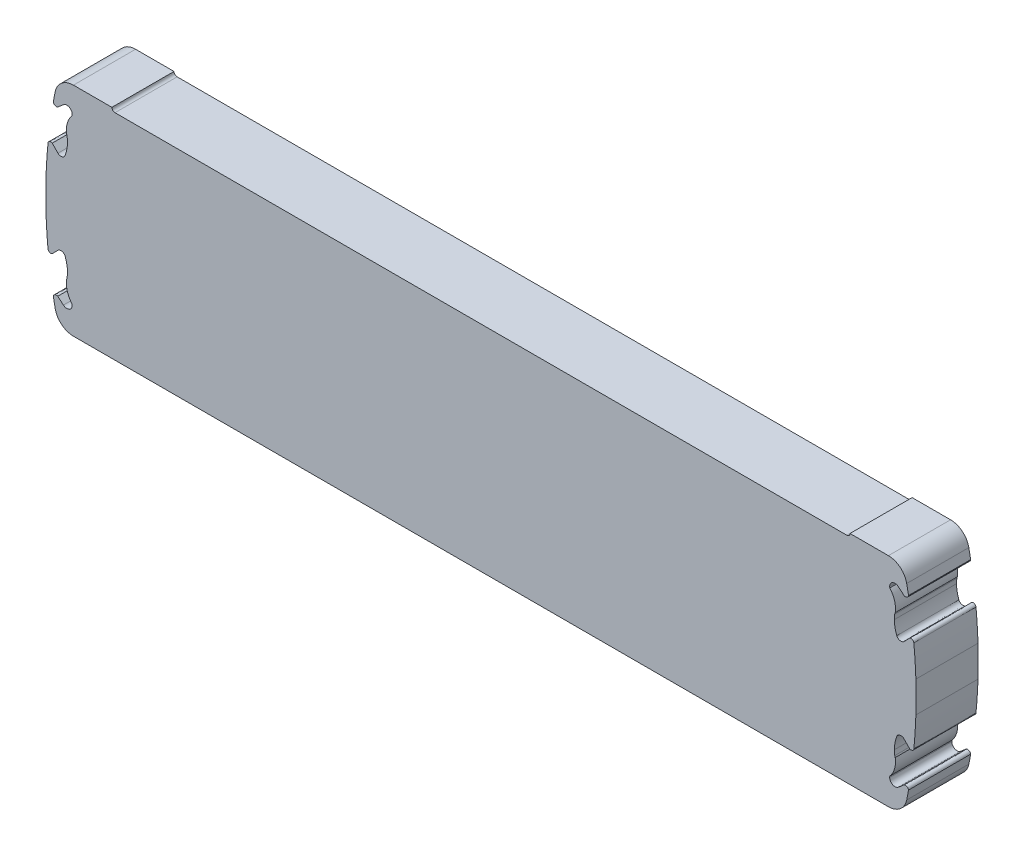
from build123d import *

# Parameters (mm, degrees)
BOSS_EXTRUDE1_DEPTH = 10


with BuildPart() as part:
    # Sketch4 → Boss-Extrude1 (new body)
    with BuildSketch(Plane(origin=(-596.752057113, -420.633982059, 0), x_dir=(1, 0, 0), z_dir=(0, 0, 1))):
        with BuildLine():
            ThreePointArc((537.856383508, 437.883981662), (537.502832434, 438.030428645), (537.356390004, 438.383981605))
            Line((537.356390004, 438.383981605), (531.168761831, 438.383981605))
            ThreePointArc((531.168761831, 438.383981605), (529.26806706, 437.705050192), (528.227666546, 435.975554529))
            ThreePointArc((528.227666546, 435.975554529), (528.077612298, 435.20961824), (527.93527456, 434.442210497))
            add(Edge.make_bspline(
                [(528.645043035, 434.075601683), (528.373422677, 433.904628447), (527.953061604, 434.121752875), (527.93527456, 434.442210497)],
                knots=[0, 0, 0, 0, 1, 1, 1, 1], degree=3))
            add(Edge.make_bspline(
                [(528.645043035, 434.075601683), (528.948206003, 434.333052007), (529.251368972, 434.590502331), (529.55453194, 434.847952656)],
                knots=[0, 0, 0, 0, 1, 1, 1, 1], degree=3))
            ThreePointArc((529.55453194, 434.847952656), (530.559263516, 434.927792658), (530.943234874, 433.995898908))
            ThreePointArc((530.943234874, 433.995898908), (530.266234445, 432.862780603), (530.030548766, 431.564035464))
            ThreePointArc((530.030548766, 431.564035464), (530.04199793, 431.273411596), (530.076251009, 430.984586316))
            add(Edge.make_bspline(
                [(530.076251009, 430.984586316), (530.136438997, 430.87310997), (530.153738674, 430.747609806)],
                knots=[0, 0, 0, 1, 1, 1], degree=2))
            ThreePointArc((530.153738674, 430.747609806), (530.171525682, 429.303646555), (529.832457882, 427.899944565))
            add(Edge.make_bspline(
                [(529.832457882, 427.899944565), (529.664786165, 427.456732189), (529.019825312, 427.315590122), (528.682762303, 427.652660836)],
                knots=[0, 0, 0, 0, 1, 1, 1, 1], degree=3))
            add(Edge.make_bspline(
                [(527.749025131, 428.586405192), (528.060270855, 428.275157074), (528.371516579, 427.963908955), (528.682762303, 427.652660836)],
                knots=[0, 0, 0, 0, 1, 1, 1, 1], degree=3))
            add(Edge.make_bspline(
                [(527.076105496, 428.261094814), (527.101664269, 428.559910263), (527.498966326, 428.751978492), (527.749025131, 428.586405192)],
                knots=[0, 0, 0, 0, 1, 1, 1, 1], degree=3))
            ThreePointArc((527.076105496, 428.261094814), (526.875645149, 425.825092413), (526.752056208, 423.383982457))
            Line((526.752056208, 423.383982457), (526.752056208, 418.383982457))
            ThreePointArc((526.752056208, 418.383982457), (526.875645149, 415.9428725), (527.076105496, 413.506870099))
            add(Edge.make_bspline(
                [(527.749025131, 413.181559721), (527.498966326, 413.015986421), (527.101664269, 413.20805465), (527.076105496, 413.506870099)],
                knots=[0, 0, 0, 0, 1, 1, 1, 1], degree=3))
            add(Edge.make_bspline(
                [(527.749025131, 413.181559721), (528.060270855, 413.492807839), (528.371516579, 413.804055958), (528.682763021, 414.115303358)],
                knots=[0, 0, 0, 0, 1, 1, 1, 1], degree=3))
            add(Edge.make_bspline(
                [(528.682763021, 414.115303358), (529.017832696, 414.450379772), (529.663792656, 414.313863986), (529.832459308, 413.868020888)],
                knots=[0, 0, 0, 0, 1, 1, 1, 1], degree=3))
            ThreePointArc((529.832459308, 413.868020888), (530.171527108, 412.464318898), (530.153740099, 411.020355646))
            add(Edge.make_bspline(
                [(530.153740099, 411.020355646), (530.136437403, 410.894855899), (530.076250924, 410.783379344)],
                knots=[0, 0, 0, 1, 1, 1], degree=2))
            ThreePointArc((530.076250924, 410.783379344), (530.041997846, 410.494554064), (530.030548681, 410.203930197))
            ThreePointArc((530.030548681, 410.203930197), (530.26623436, 408.905185058), (530.94323479, 407.772066752))
            ThreePointArc((530.94323479, 407.772066752), (530.559263583, 406.840182612), (529.554540169, 406.920012427))
            add(Edge.make_bspline(
                [(528.645032562, 407.692363435), (528.948201765, 407.434913099), (529.251370967, 407.177462763), (529.554540169, 406.920012427)],
                knots=[0, 0, 0, 0, 1, 1, 1, 1], degree=3))
            add(Edge.make_bspline(
                [(527.93527456, 407.325754416), (527.953065541, 407.64620576), (528.37341291, 407.863326434), (528.645032562, 407.692363435)],
                knots=[0, 0, 0, 0, 1, 1, 1, 1], degree=3))
            ThreePointArc((527.93527456, 407.325754416), (528.077612382, 406.558346229), (528.227666724, 405.792409498))
            ThreePointArc((528.227666724, 405.792409498), (529.268067244, 404.062913858), (531.168762002, 403.383982456))
            Line((531.168762002, 403.383982456), (537.00283853, 403.383982456))
            Line((537.00283853, 403.383982456), (538.002825655, 403.383982456))
            Line((538.002825655, 403.383982456), (655.501288571, 403.383982456))
            Line((655.501288571, 403.383982456), (656.501275696, 403.383982456))
            Line((656.501275696, 403.383982456), (662.335352383, 403.383982456))
            ThreePointArc((662.335352383, 403.383982456), (664.236047153, 404.062913868), (665.276447667, 405.79240953))
            ThreePointArc((665.276447667, 405.79240953), (665.426501922, 406.558345849), (665.568839666, 407.325753624))
            add(Edge.make_bspline(
                [(664.859071191, 407.692362438), (665.130691549, 407.863335674), (665.551052622, 407.646211246), (665.568839666, 407.325753624)],
                knots=[0, 0, 0, 0, 1, 1, 1, 1], degree=3))
            add(Edge.make_bspline(
                [(664.859071191, 407.692362438), (664.555908222, 407.434912114), (664.252745254, 407.17746179), (663.949582286, 406.920011465)],
                knots=[0, 0, 0, 0, 1, 1, 1, 1], degree=3))
            ThreePointArc((663.949582286, 406.920011465), (663.034925489, 406.792053361), (662.5365948, 407.569637347))
            ThreePointArc((662.5365948, 407.569637347), (662.542665938, 407.671579613), (662.560879352, 407.772065213))
            ThreePointArc((662.560879352, 407.772065213), (663.329283515, 409.181297278), (663.427863217, 410.783377805))
            add(Edge.make_bspline(
                [(663.427863217, 410.783377805), (663.367675229, 410.894854151), (663.350375552, 411.020354315)],
                knots=[0, 0, 0, 1, 1, 1], degree=2))
            ThreePointArc((663.350375552, 411.020354315), (663.309579069, 411.4158969), (663.295980241, 411.813305205))
            ThreePointArc((663.295980241, 411.813305205), (663.390671322, 412.857693016), (663.671656343, 413.868019556))
            add(Edge.make_bspline(
                [(663.671656343, 413.868019556), (663.83932806, 414.311231933), (664.484288913, 414.452373999), (664.821351923, 414.115303285)],
                knots=[0, 0, 0, 0, 1, 1, 1, 1], degree=3))
            add(Edge.make_bspline(
                [(665.755089095, 413.181558929), (665.443843371, 413.492807047), (665.132597647, 413.804055166), (664.821351923, 414.115303285)],
                knots=[0, 0, 0, 0, 1, 1, 1, 1], degree=3))
            add(Edge.make_bspline(
                [(666.42800873, 413.506869307), (666.402449957, 413.208053858), (666.005147899, 413.015985629), (665.755089095, 413.181558929)],
                knots=[0, 0, 0, 0, 1, 1, 1, 1], degree=3))
            ThreePointArc((666.42800873, 413.506869307), (666.628469077, 415.942871708), (666.752058017, 418.383981664))
            Line((666.752058017, 418.383981664), (666.752058017, 423.383981664))
            ThreePointArc((666.752058017, 423.383981664), (666.628469077, 425.825091621), (666.42800873, 428.261094022))
            add(Edge.make_bspline(
                [(665.755089095, 428.5864044), (666.0051479, 428.7519777), (666.402449957, 428.559909471), (666.42800873, 428.261094022)],
                knots=[0, 0, 0, 0, 1, 1, 1, 1], degree=3))
            add(Edge.make_bspline(
                [(665.755089095, 428.5864044), (665.443843371, 428.275156282), (665.132597647, 427.963908163), (664.821351205, 427.652660763)],
                knots=[0, 0, 0, 0, 1, 1, 1, 1], degree=3))
            add(Edge.make_bspline(
                [(664.821351205, 427.652660763), (664.486281529, 427.317584349), (663.84032157, 427.454100135), (663.671654918, 427.899943234)],
                knots=[0, 0, 0, 0, 1, 1, 1, 1], degree=3))
            ThreePointArc((663.671654918, 427.899943234), (663.390669906, 428.910269722), (663.295978816, 429.95465748))
            ThreePointArc((663.295978816, 429.95465748), (663.309578212, 430.352065799), (663.350374127, 430.747608475))
            add(Edge.make_bspline(
                [(663.350374127, 430.747608475), (663.367673803, 430.873108638), (663.427861792, 430.984584985)],
                knots=[0, 0, 0, 1, 1, 1], degree=2))
            ThreePointArc((663.427861792, 430.984584985), (663.329282089, 432.586665512), (662.560877926, 433.995897577))
            ThreePointArc((662.560877926, 433.995897577), (662.542666024, 434.096379128), (662.53659539, 434.198317163))
            ThreePointArc((662.53659539, 434.198317163), (663.034920482, 434.975898575), (663.949573523, 434.847951066))
            add(Edge.make_bspline(
                [(664.859081663, 434.075600686), (664.555912283, 434.333050813), (664.252742903, 434.590500939), (663.949573523, 434.847951066)],
                knots=[0, 0, 0, 0, 1, 1, 1, 1], degree=3))
            add(Edge.make_bspline(
                [(665.568839666, 434.442209705), (665.551048684, 434.121758361), (665.130701316, 433.904637687), (664.859081663, 434.075600686)],
                knots=[0, 0, 0, 0, 1, 1, 1, 1], degree=3))
            ThreePointArc((665.568839666, 434.442209705), (665.426501849, 435.209617861), (665.276447514, 435.975554561))
            ThreePointArc((665.276447514, 435.975554561), (664.236046994, 437.705050202), (662.335352236, 438.383981605))
            Line((662.335352236, 438.383981605), (656.147724221, 438.383981605))
            ThreePointArc((656.147724221, 438.383981605), (656.001281792, 438.030428645), (655.647730718, 437.883981662))
            Line((655.647730718, 437.883981662), (537.856383508, 437.883981662))
        make_face()
    extrude(amount=BOSS_EXTRUDE1_DEPTH)


solid = part.part
